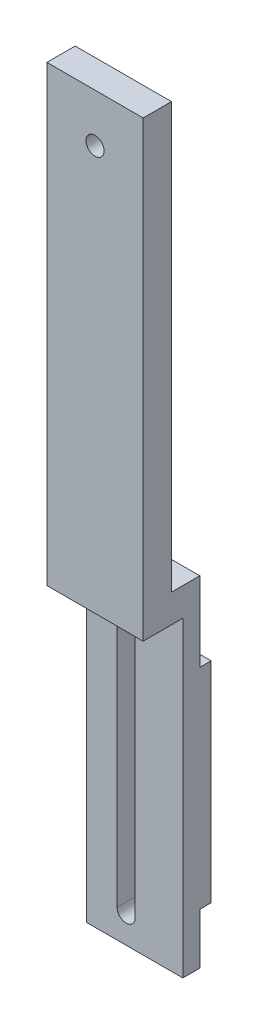
from build123d import *

# Parameters (mm, degrees)
SKETCH1_W           = 17
SKETCH1_H           = 60
BOSS_EXTRUDE1_DEPTH = 5
SKETCH2_W           = 17
SKETCH2_H           = 5
BOSS_EXTRUDE2_DEPTH = 7
SKETCH3_W           = 17
SKETCH3_H           = 5
BOSS_EXTRUDE3_DEPTH = 75
SKETCH4_R           = 1.6
CUT_EXTRUDE1_DEPTH  = 106.575802152
CUT_EXTRUDE2_DEPTH  = 2


with BuildPart() as part:
    # Sketch1 → Boss-Extrude1 (new body)
    with BuildSketch(Plane.XY):
        Rectangle(SKETCH1_W, SKETCH1_H)
        with BuildLine():
            Line((0.1, 20), (0.1, -25))
            ThreePointArc((0.1, -25), (-1.5, -26.6), (-3.1, -25))
            Line((-3.1, -25), (-3.1, 20))
            ThreePointArc((-3.1, 20), (-1.5, 21.6), (0.1, 20))
        make_face(mode=Mode.SUBTRACT)
    extrude(amount=BOSS_EXTRUDE1_DEPTH)

    # Sketch2 → Boss-Extrude2 (add)
    with BuildSketch(Plane.XY.offset(5)):
        with Locations((0, 27.5)):
            Rectangle(SKETCH2_W, SKETCH2_H)
    extrude(amount=BOSS_EXTRUDE2_DEPTH)

    # Sketch3 → Boss-Extrude3 (add)
    with BuildSketch(Plane(origin=(0, 30, 0), x_dir=(1, 0, 0), z_dir=(0, 1, 0))):
        with Locations((0, -9.5)):
            Rectangle(SKETCH3_W, SKETCH3_H)
    extrude(amount=BOSS_EXTRUDE3_DEPTH)

    # Sketch4 → Cut-Extrude1 (cut, through all)
    with BuildSketch(Plane(origin=(0, 0, 7), x_dir=(-1, 0, 0), z_dir=(0, 0, -1))):
        with Locations((0, 96.5)):
            Circle(SKETCH4_R)
    extrude(amount=-CUT_EXTRUDE1_DEPTH, mode=Mode.SUBTRACT)

    # Sketch5 → Cut-Extrude2 (cut)
    with BuildSketch(Plane(origin=(0, 0, 0), x_dir=(-1, 0, 0), z_dir=(0, 0, -1))):
        Polygon((-0.5, 21.6), (-0.5, 30), (-8.5, 30), (-8.5, 16), (-0.5, 16), align=None)
        with BuildLine():
            Line((1.5, 21.6), (-0.5, 21.6))
            Line((-0.5, 21.6), (-0.5, 16))
            Line((-0.5, 16), (-0.1, 16))
            Line((-0.1, 16), (-0.1, 20))
            ThreePointArc((-0.1, 20), (0.36862915, 21.13137085), (1.5, 21.6))
        make_face()
        Polygon((-0.5, -21), (-8.5, -21), (-8.5, -30), (-0.5, -30), (-0.5, -26.6), align=None)
        with BuildLine():
            Line((-0.1, -21), (-0.5, -21))
            Line((-0.5, -21), (-0.5, -26.6))
            Line((-0.5, -26.6), (1.5, -26.6))
            ThreePointArc((1.5, -26.6), (0.36862915, -26.13137085), (-0.1, -25))
            Line((-0.1, -25), (-0.1, -21))
        make_face()
    extrude(amount=-CUT_EXTRUDE2_DEPTH, mode=Mode.SUBTRACT)


solid = part.part
